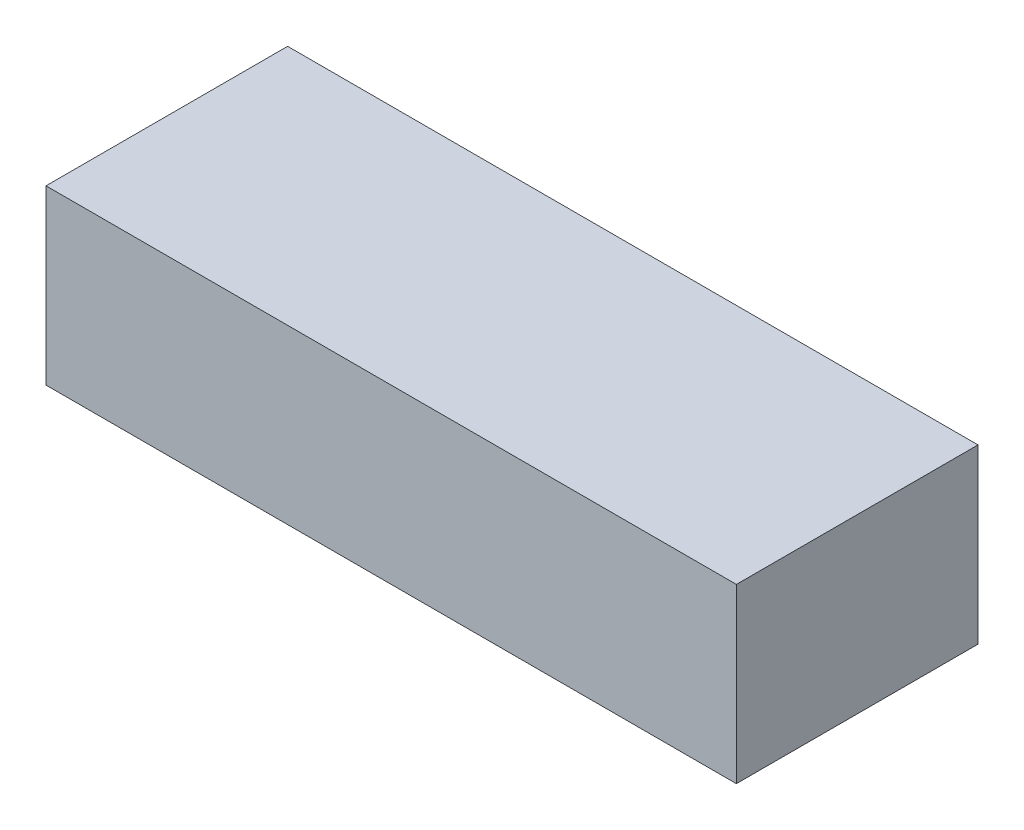
from build123d import *

# Parameters (mm, degrees)
SKETCH1_W           = 200
SKETCH1_H           = 70
BOSS_EXTRUDE1_DEPTH = 50


with BuildPart() as part:
    # Sketch1 → Boss-Extrude1 (new body)
    with BuildSketch(Plane(origin=(0, 0, 0), x_dir=(1, 0, 0), z_dir=(0, 1, 0))):
        Rectangle(SKETCH1_W, SKETCH1_H)
    extrude(amount=BOSS_EXTRUDE1_DEPTH)


solid = part.part
